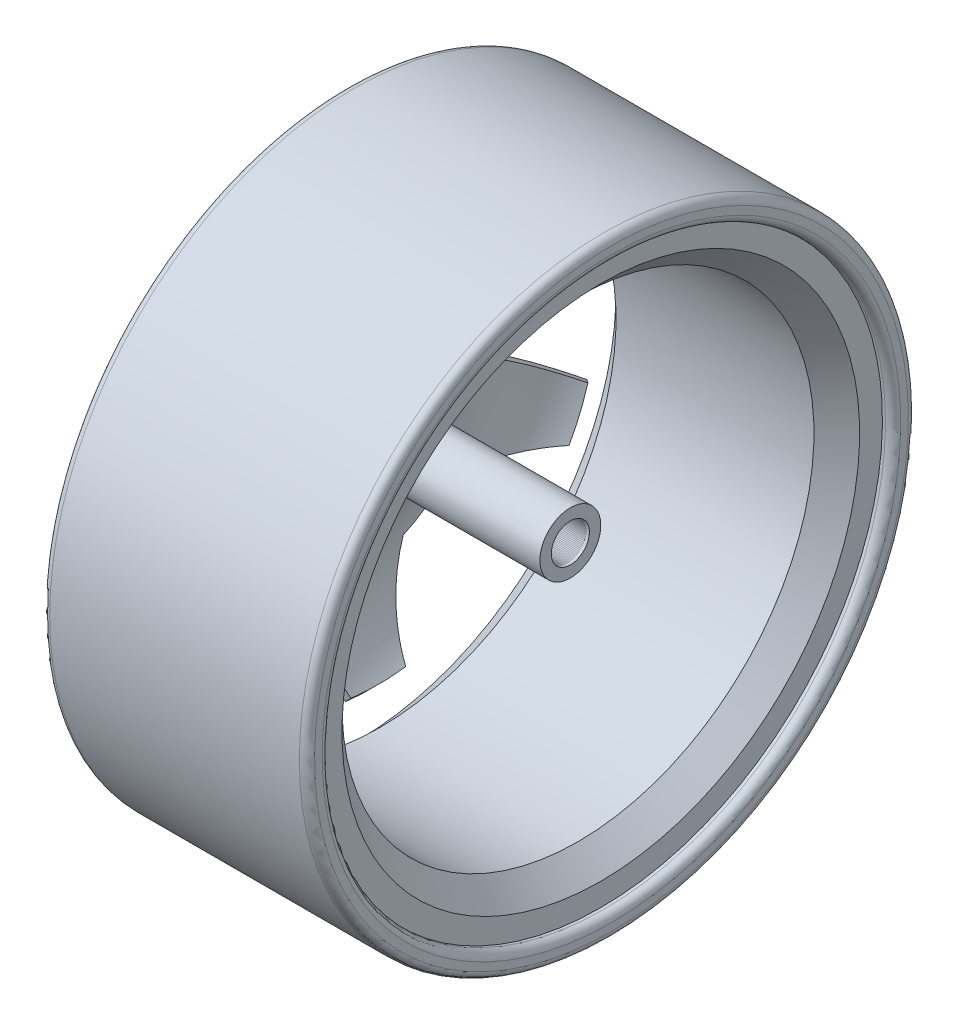
from build123d import *

# Parameters (mm, degrees)
CUT_EXTRUDE1_DEPTH      = 28.692735784
CUT_EXTRUDE1_DEPTH_BACK = 10
FILLET1_R               = 0.5
FILLET2_R               = 0.1
BOSS_EXTRUDE1_START     = -0.2
SKETCH9_R               = 1.5
SKETCH9_R_2             = 1.25
BOSS_EXTRUDE1_DEPTH     = 10


with BuildPart() as part:
    # Sketch1 → Revolve1 (revolve)
    with BuildSketch(Plane.XY, mode=Mode.PRIVATE) as revolve1_sk:
        Polygon((-6.5, 15.5), (0, 15.5), (6.5, 15.5), (8, 17), (8, 18.5), (6.5, 18.5), (5, 16.5), (0, 16.5), (-5, 16.5), (-6.5, 18.5), (-8, 18.5), (-8, 17), align=None)
    revolve(revolve1_sk.sketch.rotate(Axis((-5, 0, 0), (1, 0, 0)), 180), axis=Axis((-5, 0, 0), (1, 0, 0)))


with BuildPart() as body_2:
    # Sketch2 → Revolve2 (revolve)
    with BuildSketch(Plane.XY, mode=Mode.PRIVATE) as revolve2_sk:
        with BuildLine():
            Line((-6, 2.5), (-4.5, 2.5))
            Line((-4.5, 2.5), (-4.5, 1.25))
            Line((-4.5, 1.25), (-3.75, 1.25))
            Line((-3.75, 1.25), (-3.75, 2.5))
            Line((-3.75, 2.5), (6, 2.5))
            Line((6, 2.5), (6, 3.25))
            Line((6, 3.25), (-5.25, 3.25))
            Line((-5.25, 3.25), (-5.25, 4.5))
            ThreePointArc((-5.25, 4.5), (-8.212335998, 9.775074553), (-6.608583193, 15.608583193))
            Line((-6.608583193, 15.608583193), (-7.138913279, 16.138913279))
            ThreePointArc((-7.138913279, 16.138913279), (-9.038105106, 10.077889712), (-6, 4.5))
            Line((-6, 4.5), (-6, 2.5))
        make_face()
    revolve(revolve2_sk.sketch.rotate(Axis((-4.5, 1.25, 0), (1, 0, 0)), 90), axis=Axis((-4.5, 1.25, 0), (1, 0, 0)))

    # Sketch6 → Cut-Extrude1 (cut, two sides: drawn at the far end of the back side and taken through both)
    with BuildSketch(Plane(origin=(0, 0, 0), x_dir=(0, 0, -1), z_dir=(1, 0, 0)).offset(-CUT_EXTRUDE1_DEPTH_BACK)):
        with BuildLine():
            Line((8.474907453, 13.49155555), (1.5, 7.638913279))
            ThreePointArc((1.5, 7.638913279), (0, 7.812637647), (-1.5, 7.638913279))
            Line((-1.5, 7.638913279), (-8.474907453, 13.49155555))
            ThreePointArc((-8.474907453, 13.49155555), (0, 16.138913279), (8.474907453, 13.49155555))
        make_face()
        with BuildLine():
            Line((7.728563743, 0.933969247), (14.230438646, -3.12885311))
            ThreePointArc((14.230438646, -3.12885311), (14.387842127, 5.080109341), (10.169965653, 12.124352268))
            Line((10.169965653, 12.124352268), (6.80151276, 3.787138796))
            ThreePointArc((6.80151276, 3.787138796), (7.430259943, 2.414237804), (7.728563743, 0.933969247))
        make_face()
        with BuildLine():
            Line((3.276515077, -7.061688539), (1.262236771, -15.140517566))
            ThreePointArc((1.262236771, -15.140517566), (9.251095144, -12.338949422), (14.786481538, -5.933472105))
            Line((14.786481538, -5.933472105), (5.70356606, -5.298332783))
            ThreePointArc((5.70356606, -5.298332783), (4.59215319, -6.320556627), (3.276515077, -7.061688539))
        make_face()
        with BuildLine():
            Line((-5.70356606, -5.298332783), (-14.786481538, -5.933472105))
            ThreePointArc((-14.786481538, -5.933472105), (-9.251095144, -12.338949422), (-1.262236771, -15.140517566))
            Line((-1.262236771, -15.140517566), (-3.276515077, -7.061688539))
            ThreePointArc((-3.276515077, -7.061688539), (-4.59215319, -6.320556627), (-5.70356606, -5.298332783))
        make_face()
        with BuildLine():
            Line((-6.80151276, 3.787138796), (-10.169965653, 12.124352268))
            ThreePointArc((-10.169965653, 12.124352268), (-14.387842127, 5.080109341), (-14.230438646, -3.12885311))
            Line((-14.230438646, -3.12885311), (-7.728563743, 0.933969247))
            ThreePointArc((-7.728563743, 0.933969247), (-7.430259943, 2.414237804), (-6.80151276, 3.787138796))
        make_face()
    extrude(amount=CUT_EXTRUDE1_DEPTH + CUT_EXTRUDE1_DEPTH_BACK, mode=Mode.SUBTRACT)

    # Fillet1
    fillet1_edges = [body_2.edges().sort_by_distance(p)[0] for p in [
        (-6, 1.25, -3.25),
        (-6, 1.25, -1.25),
        (-4.5, 1.25, -1.25),
    ]]
    fillet(fillet1_edges, radius=FILLET1_R)

    # Fillet2
    fillet2_edges = [body_2.edges().sort_by_distance(p)[0] for p in [
        (-8.875625942, -1.204261103, 11.150447603),
        (-7.138913279, -4.499967529, 13.733812728),
        (-8.78774529, -5.570164461, 9.590940165),
        (-9.04065933, -6.32052965, 4.592190318),
        (-8.726466529, -10.483292341, 2.423413435),
        (-7.138913279, -13.638913279, 0),
        (-8.726466529, -10.483292341, -2.423413435),
        (-9.04065933, -6.32052965, -4.592190318),
        (-8.78774529, -5.570164461, -9.590940165),
        (-7.138913279, -4.499967529, -13.733812728),
        (-8.875625931, -1.204261102, -11.150447601),
        (-8.80120099, 2.414652978, -7.430125028),
        (-8.961058858, 8.138105675, -8.559417486),
        (-7.138913279, 12.838986329, -9.347466742),
        (-8.480210109, 7.812637647, 0),
        (-8.999233032, 10.685394782, 5.130655276),
        (-7.138913279, 12.838986329, 9.347466742),
        (-8.961058857, 8.138105675, 8.559417486),
        (-8.794377207, 2.565146392, 7.37919349),
        (-8.999233031, 10.685394782, -5.130655276),
    ]]
    fillet(fillet2_edges, radius=FILLET2_R)


with BuildPart() as body_3:
    # Sketch8 → Revolve3 (revolve)
    with BuildSketch(Plane.XY, mode=Mode.PRIVATE) as revolve3_sk:
        with BuildLine():
            Line((-8.2, 18.5), (-6.5, 18.5))
            Line((-6.5, 18.5), (-5, 16.5))
            Line((-5, 16.5), (5, 16.5))
            Line((5, 16.5), (6.5, 18.5))
            Line((6.5, 18.5), (8.2, 18.5))
            ThreePointArc((8.2, 18.5), (8.553553391, 18.646446609), (8.7, 19))
            Line((8.7, 19), (8.7, 19.5))
            ThreePointArc((8.7, 19.5), (8.553553391, 19.853553391), (8.2, 20))
            Line((8.2, 20), (-8.2, 20))
            ThreePointArc((-8.2, 20), (-8.553553391, 19.853553391), (-8.7, 19.5))
            Line((-8.7, 19.5), (-8.7, 19))
            ThreePointArc((-8.7, 19), (-8.553553391, 18.646446609), (-8.2, 18.5))
        make_face()
    revolve(revolve3_sk.sketch.rotate(Axis((-5, 0, 0), (1, 0, 0)), 180), axis=Axis((-5, 0, 0), (1, 0, 0)))


with BuildPart() as body_4:
    # Sketch9 → Boss-Extrude1 (new body)
    with BuildSketch(Plane(origin=(6, 0, 0), x_dir=(0, 0, -1), z_dir=(1, 0, 0)).offset(BOSS_EXTRUDE1_START)):
        with Locations((0, 1.25)):
            Circle(SKETCH9_R)
        with Locations((0, 1.25)):
            Circle(SKETCH9_R_2, mode=Mode.SUBTRACT)
    extrude(amount=-BOSS_EXTRUDE1_DEPTH)


solid = Compound([part.part, body_2.part, body_3.part, body_4.part])
